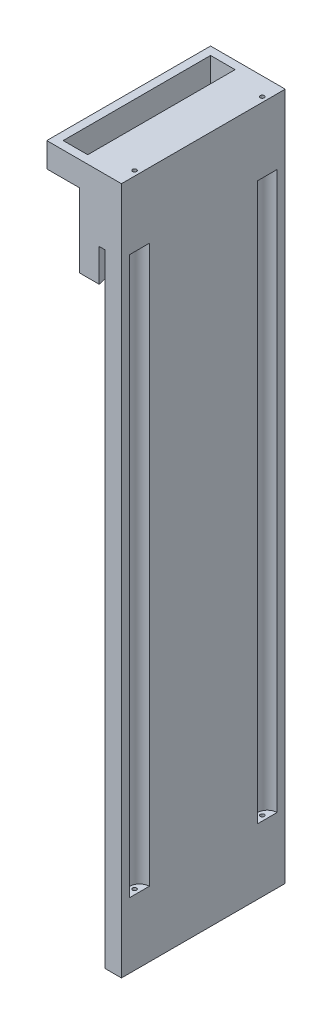
from build123d import *

# Parameters (mm, degrees)
BOSS_EXTRUDE1_DEPTH      = 50
SKETCH3_W                = 5
SKETCH3_H                = 50
BOSS_EXTRUDE3_DEPTH      = 180
CORTE_EXTRUS_O1_DEPTH    = 10
ESBO_O3_W                = 50
ESBO_O3_H                = 7.5
RESSALTO_EXTRUS_O2_DEPTH = 10
ESBO_O4_W                = 7.5
ESBO_O4_H                = 45
CORTE_EXTRUS_O2_DEPTH    = 10
CORTE_EXTRUS_O3_START    = -20
CORTE_EXTRUS_O3_DEPTH    = 170
ESBO_O6_R                = 0.6
CORTE_EXTRUS_O4_DEPTH    = 195
PADR_O_LINEAR1_COUNT     = 2
PADR_O_LINEAR1_PITCH     = 39


with BuildPart() as part:
    # Sketch1 → Boss-Extrude1 (new body)
    with BuildSketch(Plane.XY):
        Polygon((0, 0), (0, 30), (12.8, 30), (12.8, 0), (7.8, 0), (7.8, 10), (6, 10), (6, 0), align=None)
    extrude(amount=BOSS_EXTRUDE1_DEPTH)

    # Sketch3 → Boss-Extrude3 (add)
    with BuildSketch(Plane.XZ):
        with Locations((10.3, 25)):
            Rectangle(SKETCH3_W, SKETCH3_H)
    extrude(amount=BOSS_EXTRUDE3_DEPTH)

    # Esboço2 → Corte-extrusão1 (cut)
    with BuildSketch(Plane.XZ):
        with BuildLine():
            Line((6, 50), (6, 0))
            ThreePointArc((6, 0), (2.708949196, 25), (6, 50))
        make_face()
    extrude(amount=-CORTE_EXTRUS_O1_DEPTH, mode=Mode.SUBTRACT)

    # Esboço3 → Ressalto-extrusão2 (add)
    with BuildSketch(Plane.ZY):
        with Locations((25, 26.25)):
            Rectangle(ESBO_O3_W, ESBO_O3_H)
    extrude(amount=RESSALTO_EXTRUS_O2_DEPTH)

    # Esboço4 → Corte-extrusão2 (cut)
    with BuildSketch(Plane.XZ.offset(-22.5)):
        with Locations((-3.75, 25)):
            Rectangle(ESBO_O4_W, ESBO_O4_H)
    extrude(amount=-CORTE_EXTRUS_O2_DEPTH, mode=Mode.SUBTRACT)

    # Esboço5 → Corte-extrusão3 (cut)
    with BuildSketch(Plane(origin=(0, 30, 0), x_dir=(1, 0, 0), z_dir=(0, 1, 0)).offset(CORTE_EXTRUS_O3_START)):
        with BuildLine():
            Line((12.8, -41.5000945), (12.8, -47.5))
            ThreePointArc((12.8, -47.5), (9.816837413, -44.50004725), (12.8, -41.5000945))
        make_face()
    corte_extrus_o3 = extrude(amount=-CORTE_EXTRUS_O3_DEPTH, mode=Mode.SUBTRACT)

    # Esboço6 → Corte-extrusão4 (cut)
    with BuildSketch(Plane(origin=(0, 30, 0), x_dir=(1, 0, 0), z_dir=(0, 1, 0))):
        with Locations(Location((11.3, -44.5, 0), (0, 0, 270))):
            Circle(ESBO_O6_R)
    corte_extrus_o4 = extrude(amount=-CORTE_EXTRUS_O4_DEPTH, mode=Mode.SUBTRACT)

    # Padrão linear1: Corte-extrusão3, Corte-extrusão4 ×2
    with Locations(*[(0, 0, -i * PADR_O_LINEAR1_PITCH) for i in range(1, PADR_O_LINEAR1_COUNT)]):
        add(corte_extrus_o3, mode=Mode.SUBTRACT)
        add(corte_extrus_o4, mode=Mode.SUBTRACT)


solid = part.part
